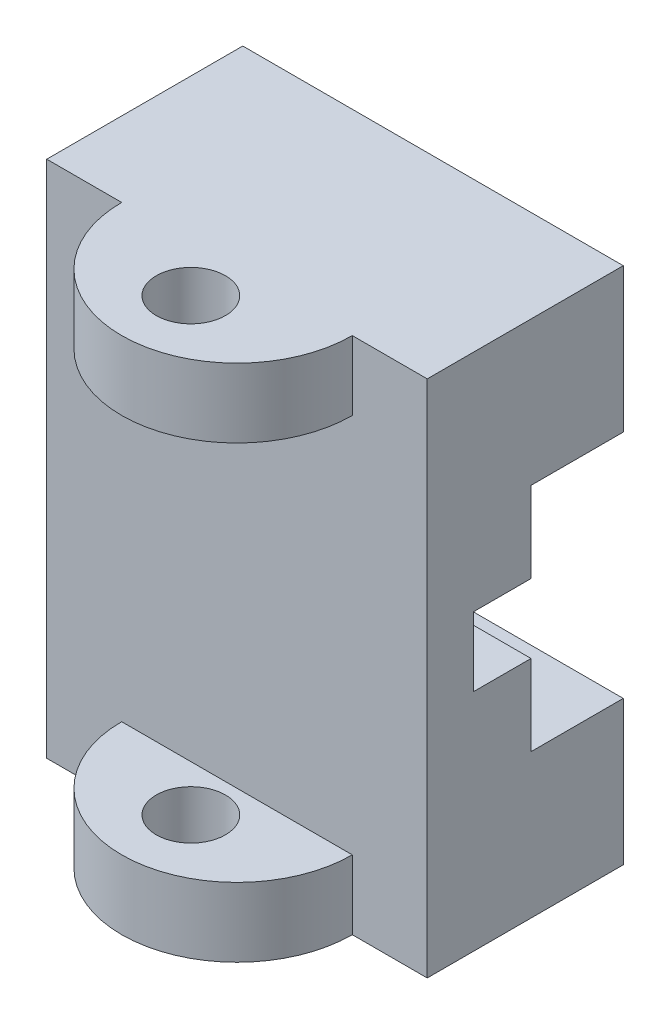
from build123d import *

# Parameters (mm, degrees)
SKETCH_1_W          = 33
SKETCH_1_H          = 45
EXTRUDE_1_DEPTH     = 17
SKETCH_2_W          = 5
SKETCH_2_H          = 6
CUT_EXTRUDE_1_DEPTH = 44.407948581
SKETCH_4_R          = 3
EXTRUDE_2_DEPTH     = 6


with BuildPart() as part:
    # Эскиз1 → Бобышка-Вытянуть1 (new body)
    with BuildSketch(Plane.XY):
        Rectangle(SKETCH_1_W, SKETCH_1_H)
    extrude(amount=EXTRUDE_1_DEPTH)

    # Эскиз2 → Вырез-Вытянуть1 (cut, through all)
    with BuildSketch(Plane.ZY.offset(16.5)):
        Polygon((8, 3), (8, 10), (0, 10), (0, -10), (8, -10), (8, -3), align=None)
        with Locations((10.5, 0)):
            Rectangle(SKETCH_2_W, SKETCH_2_H)
    extrude(amount=-CUT_EXTRUDE_1_DEPTH, mode=Mode.SUBTRACT)

    # Эскиз4 → Бобышка-Вытянуть2 (add)
    with BuildSketch(Plane.XZ.offset(22.5)):
        with BuildLine():
            Line((-10, 17), (10, 17))
            ThreePointArc((10, 17), (0, 27), (-10, 17))
        make_face()
        with Locations((0, 21)):
            Circle(SKETCH_4_R, mode=Mode.SUBTRACT)
    extrude_2 = extrude(amount=-EXTRUDE_2_DEPTH)

    # Зеркальное отражение1: Бобышка-Вытянуть2 across plane
    add(extrude_2.mirror(Plane.ZX))


solid = part.part
